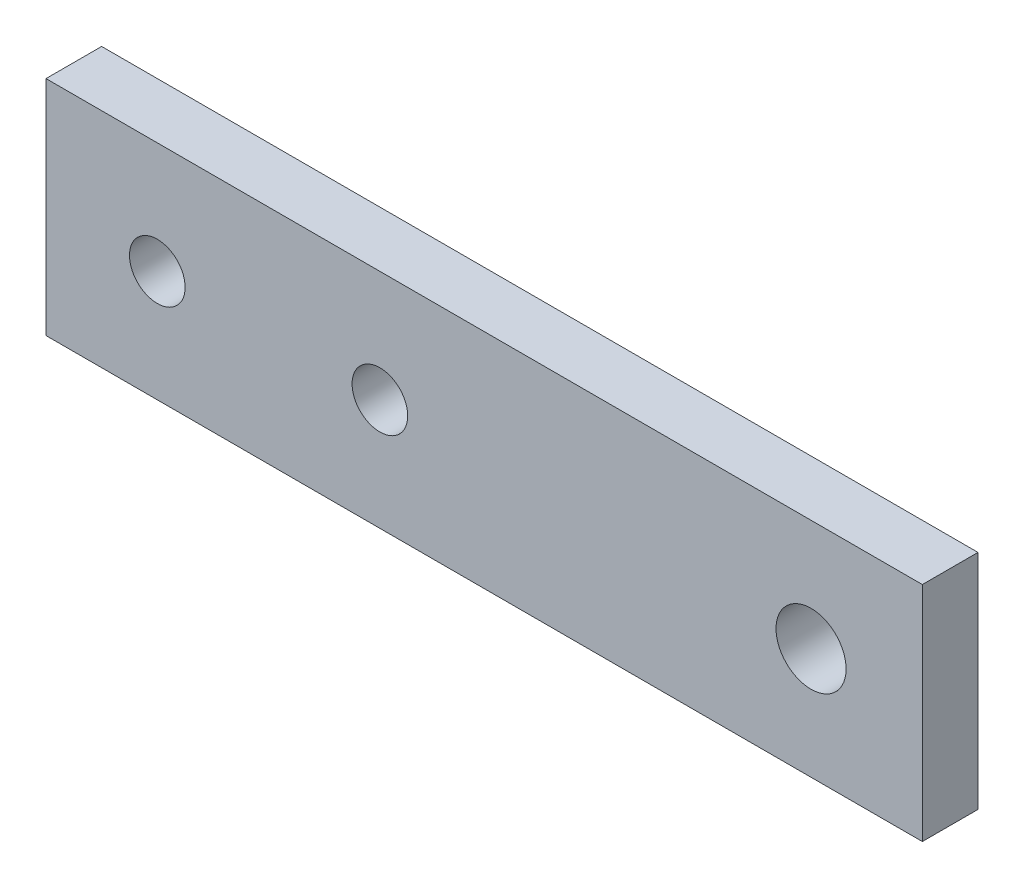
from build123d import *

# Parameters (mm, degrees)
SKETCH1_W           = 6.35
SKETCH1_H           = 25.4
BOSS_EXTRUDE1_DEPTH = 100
SKETCH2_R           = 3.175
SKETCH2_R_2         = 4
CUT_EXTRUDE1_DEPTH  = 104.370607525


with BuildPart() as part:
    # Sketch1 → Boss-Extrude1 (new body)
    with BuildSketch(Plane(origin=(0, 0, 0), x_dir=(0, 0, -1), z_dir=(1, 0, 0))):
        with Locations((3.175, 12.7)):
            Rectangle(SKETCH1_W, SKETCH1_H)
    extrude(amount=BOSS_EXTRUDE1_DEPTH)

    # Sketch2 → Cut-Extrude1 (cut, through all)
    with BuildSketch(Plane.XY):
        with Locations((12.7, 12.7)):
            Circle(SKETCH2_R)
        with Locations((38.1, 12.7)):
            Circle(SKETCH2_R)
        with Locations((87.3, 12.7)):
            Circle(SKETCH2_R_2)
    extrude(amount=-CUT_EXTRUDE1_DEPTH, mode=Mode.SUBTRACT)


solid = part.part
